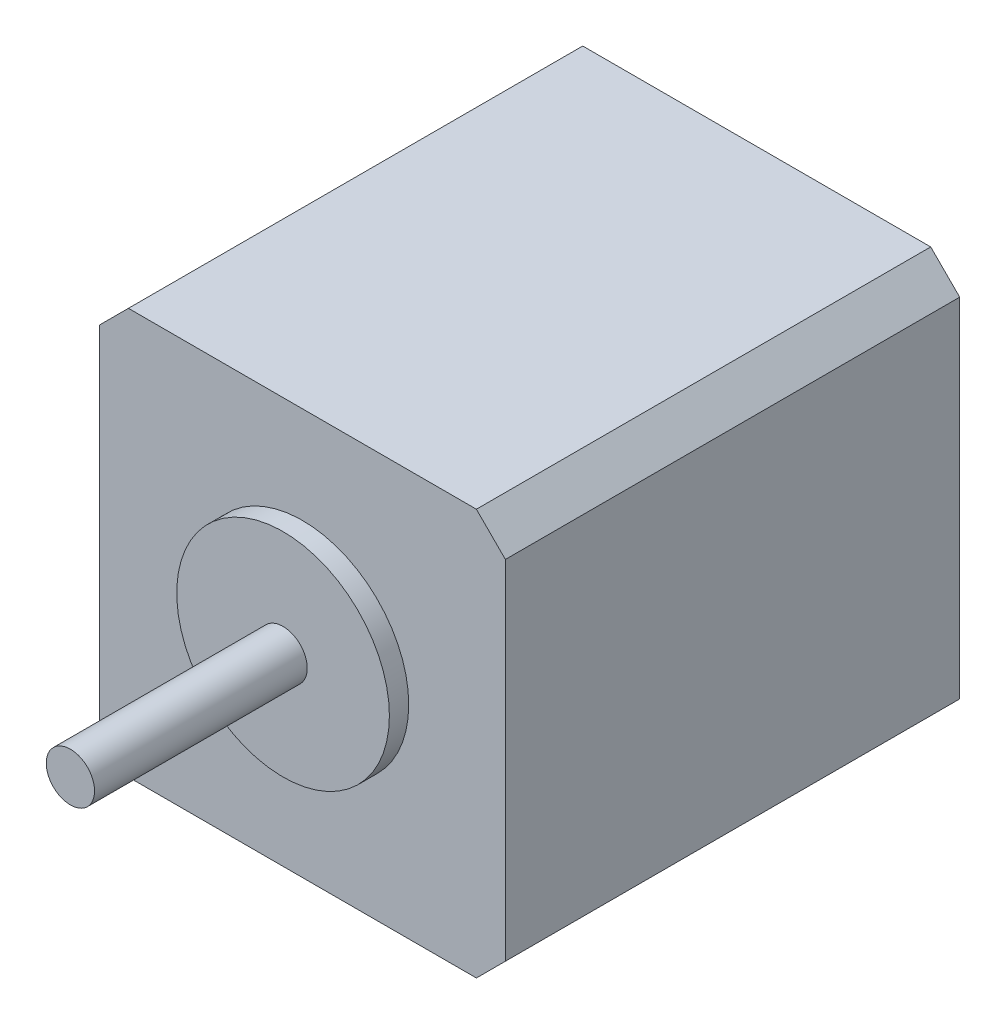
from build123d import *

# Parameters (mm, degrees)
SKETCH_1_W      = 42
SKETCH_1_H      = 42
EXTRUDE_1_DEPTH = 47
CHAMFER_1_SIZE  = 3
SKETCH_2_R      = 11
EXTRUDE_2_DEPTH = 2
SKETCH_3_R      = 2.5
EXTRUDE_3_DEPTH = 22


with BuildPart() as part:
    # 草图1 → 凸台-拉伸1 (new body)
    with BuildSketch(Plane.XY):
        with Locations((-21, 21)):
            Rectangle(SKETCH_1_W, SKETCH_1_H)
    extrude(amount=EXTRUDE_1_DEPTH)

    # 倒角1
    chamfer_1_edges = [part.edges().sort_by_distance(p)[0] for p in [
        (0, 0, 23.5),
        (-42, 0, 23.5),
        (-42, 42, 23.5),
        (0, 42, 23.5),
    ]]
    chamfer(chamfer_1_edges, length=CHAMFER_1_SIZE)

    # 草图2 → 凸台-拉伸2 (add)
    with BuildSketch(Plane.XY.offset(47)):
        with Locations((-21, 21)):
            Circle(SKETCH_2_R)
    extrude(amount=EXTRUDE_2_DEPTH)

    # 草图3 → 凸台-拉伸3 (add)
    with BuildSketch(Plane.XY.offset(49)):
        with Locations((-21, 21)):
            Circle(SKETCH_3_R)
    extrude(amount=EXTRUDE_3_DEPTH)


solid = part.part
